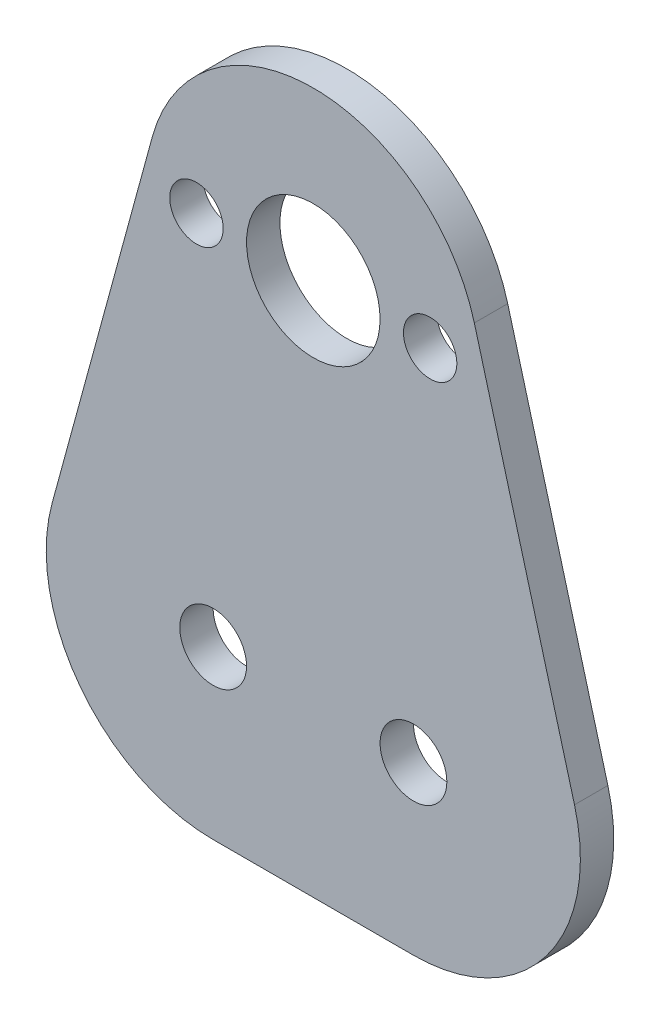
from build123d import *

# Parameters (mm, degrees)
SKETCH1_R               = 10
SKETCH1_R_2             = 5
BOSS_EXTRUDE2_DEPTH     = 2.5
CUT_EXTRUDE1_DEPTH      = 90.477650841
CUT_EXTRUDE1_DEPTH_BACK = 90.477650841
SKETCH3_R               = 4


with BuildPart() as part:
    # Sketch1 → Boss-Extrude2 (new, symmetric)
    with BuildSketch(Plane.XY):
        with BuildLine():
            Line((-39.119095531, -48.422064855), (-24.119095531, 6.577935145))
            ThreePointArc((-24.119095531, 6.577935145), (0, 25), (24.119095531, 6.577935145))
            Line((24.119095531, 6.577935145), (39.119095531, -48.422064855))
            ThreePointArc((39.119095531, -48.422064855), (34.867666932, -70.174841373), (15, -80))
            Line((15, -80), (-15, -80))
            ThreePointArc((-15, -80), (-34.867666932, -70.174841373), (-39.119095531, -48.422064855))
        make_face()
        Circle(SKETCH1_R, mode=Mode.SUBTRACT)
        with Locations((-15, -55)):
            Circle(SKETCH1_R_2, mode=Mode.SUBTRACT)
        with Locations((15, -55)):
            Circle(SKETCH1_R_2, mode=Mode.SUBTRACT)
    extrude(amount=BOSS_EXTRUDE2_DEPTH, both=True)

    # Sketch3 → Cut-Extrude1 (cut, two sides: drawn at the far end of the back side and taken through both)
    with BuildSketch(Plane.XY.offset(-CUT_EXTRUDE1_DEPTH_BACK)):
        with Locations((17.5, 0)):
            Circle(SKETCH3_R)
        with Locations((-17.5, 0)):
            Circle(SKETCH3_R)
    extrude(amount=CUT_EXTRUDE1_DEPTH + CUT_EXTRUDE1_DEPTH_BACK, mode=Mode.SUBTRACT)


solid = part.part
